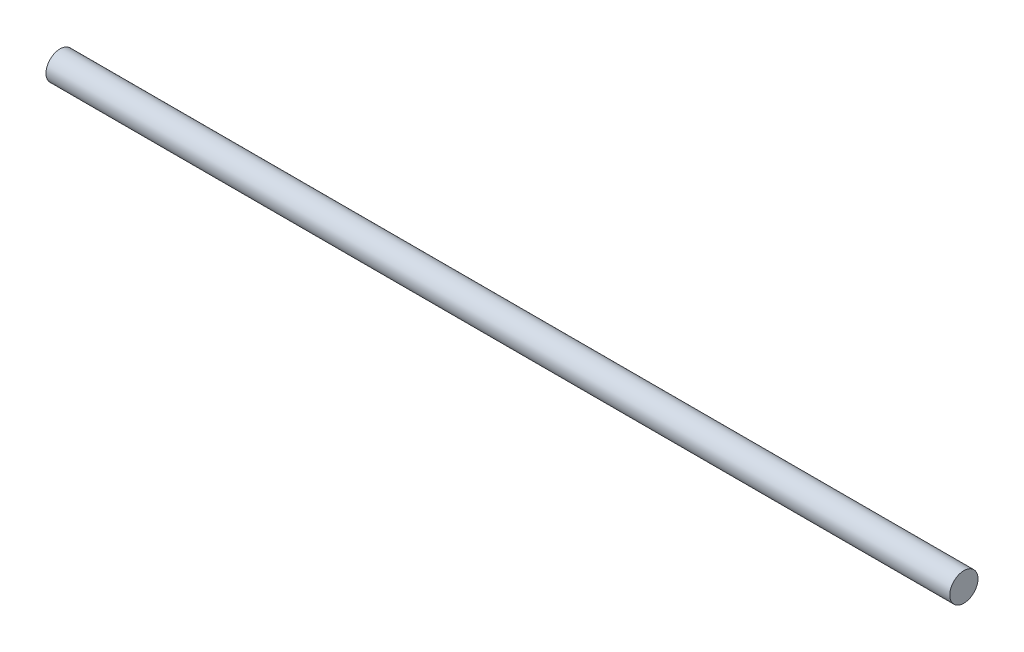
from build123d import *

# Parameters (mm, degrees)
SKETCH1_R           = 1.25
BOSS_EXTRUDE1_DEPTH = 80


with BuildPart() as part:
    # Sketch1 → Boss-Extrude1 (new body)
    with BuildSketch(Plane(origin=(0, 0, 0), x_dir=(0, 0, -1), z_dir=(1, 0, 0))):
        Circle(SKETCH1_R)
    extrude(amount=BOSS_EXTRUDE1_DEPTH)


solid = part.part
